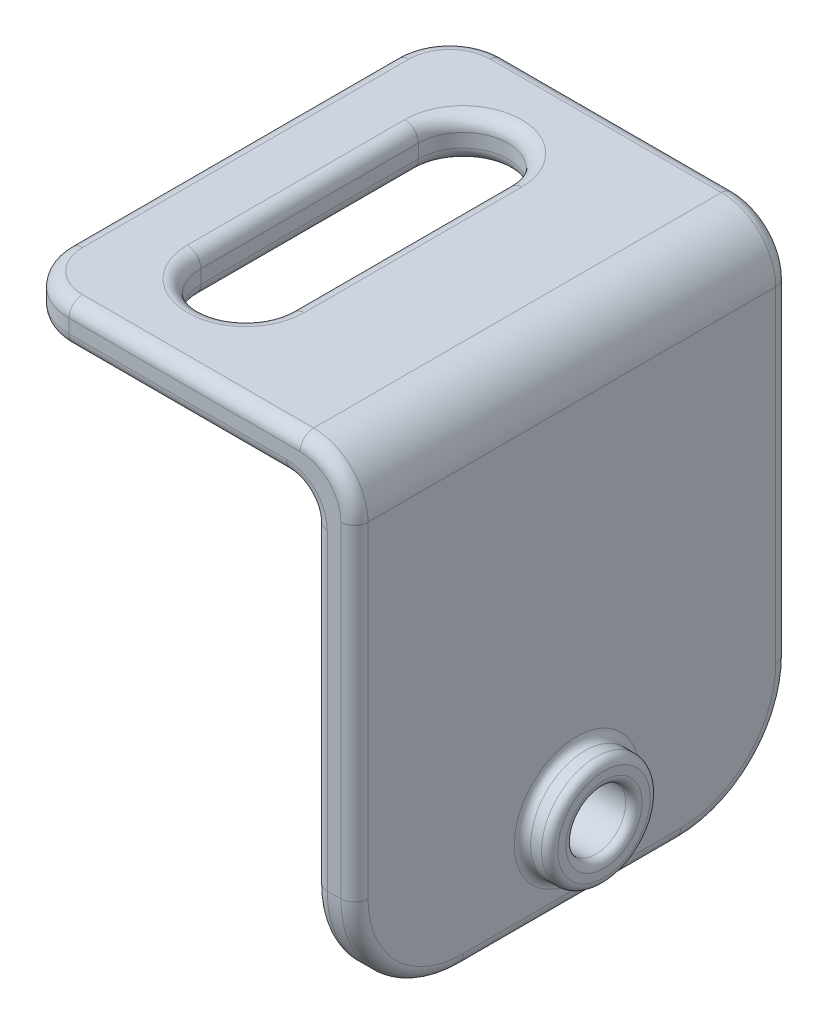
from build123d import *

# Parameters (mm, degrees)
BOSS_EXTRUDE1_DEPTH = 40.64
CUT_EXTRUDE1_DEPTH  = 69.92017484
FILLET1_R           = 10.16
FILLET2_R           = 2.54
FILLET3_R           = 5.08
FILLET4_R           = 5.08
FILLET8_R           = 1.27
FILLET9_R           = 1.27
SKETCH10_R          = 5.08
BOSS_EXTRUDE2_DEPTH = 2.54
SKETCH11_R          = 2.794
CUT_EXTRUDE4_DEPTH  = 68.704222911
FILLET10_R          = 0.762


with BuildPart() as part:
    # Sketch1 → Boss-Extrude1 (new body)
    with BuildSketch(Plane.XY):
        Polygon((0, 0), (0, 3.81), (31.75, 3.81), (31.75, -41.91), (27.94, -41.91), (27.94, 0), align=None)
    extrude(amount=BOSS_EXTRUDE1_DEPTH)

    # Sketch2 → Cut-Extrude1 (cut, through all)
    with BuildSketch(Plane(origin=(0, 3.81, 0), x_dir=(1, 0, 0), z_dir=(0, 1, 0))):
        with BuildLine():
            Line((15.621, -10.16), (15.621, -30.48))
            ThreePointArc((15.621, -30.48), (11.43, -34.671), (7.239, -30.48))
            Line((7.239, -30.48), (7.239, -10.16))
            ThreePointArc((7.239, -10.16), (11.43, -5.969), (15.621, -10.16))
        make_face()
    extrude(amount=-CUT_EXTRUDE1_DEPTH, mode=Mode.SUBTRACT)

    # Fillet1
    fillet1_edges = [part.edges().sort_by_distance(p)[0] for p in [
        (29.845, -41.91, 40.64),
        (29.845, -41.91, 0),
    ]]
    fillet(fillet1_edges, radius=FILLET1_R)

    # Fillet2
    fillet2_edges = [part.edges().sort_by_distance(p)[0] for p in [
        (27.94, 0, 20.32),
    ]]
    fillet(fillet2_edges, radius=FILLET2_R)

    # Fillet3
    fillet3_edges = [part.edges().sort_by_distance(p)[0] for p in [
        (0, 1.905, 40.64),
        (0, 1.905, 0),
    ]]
    fillet(fillet3_edges, radius=FILLET3_R)

    # Fillet4
    fillet4_edges = [part.edges().sort_by_distance(p)[0] for p in [
        (31.75, 3.81, 20.32),
    ]]
    fillet(fillet4_edges, radius=FILLET4_R)

    # Fillet8
    fillet8_edges = [part.edges().sort_by_distance(p)[0] for p in [
        (11.43, 0, 5.969),
        (15.621, 0, 20.32),
        (11.43, 0, 34.671),
        (7.239, 0, 20.32),
        (11.43, 3.81, 5.969),
        (7.239, 3.81, 20.32),
        (11.43, 3.81, 34.671),
        (15.621, 3.81, 20.32),
    ]]
    fillet(fillet8_edges, radius=FILLET8_R)

    # Fillet9
    fillet9_edges = [part.edges().sort_by_distance(p)[0] for p in [
        (31.75, -41.91, 20.32),
        (27.94, -41.91, 20.32),
        (31.75, -16.51, 0),
        (31.75, -16.51, 40.64),
        (31.75, -38.934204897, 37.664204897),
        (31.75, -38.934204897, 2.975795103),
        (27.94, -38.934204897, 37.664204897),
        (27.94, -38.934204897, 2.975795103),
        (27.94, -17.145, 0),
        (27.94, -17.145, 40.64),
        (27.196051224, -0.743948776, 0),
        (27.196051224, -0.743948776, 40.64),
        (15.24, 0, 40.64),
        (15.24, 0, 0),
        (0, 0, 20.32),
        (1.487897552, 0, 1.487897552),
        (1.487897552, 0, 39.152102448),
        (0, 3.81, 20.32),
        (1.487897552, 3.81, 1.487897552),
        (1.487897552, 3.81, 39.152102448),
        (15.875, 3.81, 40.64),
        (15.875, 3.81, 0),
        (30.262102448, 2.322102448, 0),
        (30.262102448, 2.322102448, 40.64),
    ]]
    fillet(fillet9_edges, radius=FILLET9_R)

    # Sketch10 → Boss-Extrude2 (add)
    with BuildSketch(Plane(origin=(31.75, 0, 0), x_dir=(0, 0, -1), z_dir=(1, 0, 0))):
        with Locations(Location((-19.857717474, -34.212708313, 0), (0, 0, 270))):
            Circle(SKETCH10_R)
    extrude(amount=BOSS_EXTRUDE2_DEPTH)

    # Sketch11 → Cut-Extrude4 (cut, through all)
    with BuildSketch(Plane(origin=(34.29, 0, 0), x_dir=(0, 0, -1), z_dir=(1, 0, 0))):
        with Locations(Location((-19.857717474, -34.212708313, 0), (0, 0, 90))):
            Circle(SKETCH11_R)
    extrude(amount=-CUT_EXTRUDE4_DEPTH, mode=Mode.SUBTRACT)

    # Fillet10
    fillet10_edges = [part.edges().sort_by_distance(p)[0] for p in [
        (31.75, -29.132708313, 19.857717474),
        (34.29, -29.132708313, 19.857717474),
        (34.29, -37.006708313, 19.857717474),
    ]]
    fillet(fillet10_edges, radius=FILLET10_R)


solid = part.part
